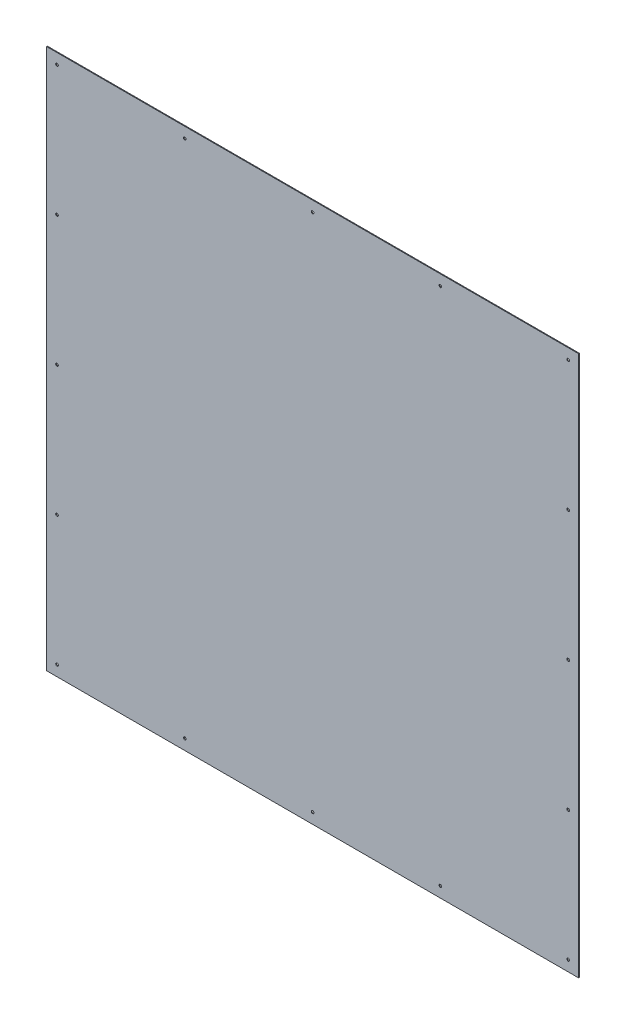
from build123d import *

# Parameters (mm, degrees)
CROQUIS1_W              = 1280
CROQUIS1_H              = 1300
SALIENTE_EXTRUIR1_DEPTH = 1.9
CROQUIS2_R              = 3.175
CORTAR_EXTRUIR2_DEPTH   = 120


with BuildPart() as part:
    # Croquis1 → Saliente-Extruir1 (new body)
    with BuildSketch(Plane.XY):
        Rectangle(CROQUIS1_W, CROQUIS1_H)
    extrude(amount=SALIENTE_EXTRUIR1_DEPTH)

    # Croquis2 → Cortar-Extruir2 (cut)
    with BuildSketch(Plane.XY.offset(1.9)):
        with Locations((-614.6, -624.6)):
            Circle(CROQUIS2_R)
        with Locations((-614.6, 624.6)):
            Circle(CROQUIS2_R)
        with Locations((614.6, 624.6)):
            Circle(CROQUIS2_R)
        with Locations((614.6, -624.6)):
            Circle(CROQUIS2_R)
        with Locations((0, -624.6)):
            Circle(CROQUIS2_R)
        with Locations((0, 624.6)):
            Circle(CROQUIS2_R)
        with Locations((307.3, -624.6)):
            Circle(CROQUIS2_R)
        with Locations((307.3, 624.6)):
            Circle(CROQUIS2_R)
        with Locations((-307.3, 624.6)):
            Circle(CROQUIS2_R)
        with Locations((-307.3, -624.6)):
            Circle(CROQUIS2_R)
        with Locations((-614.6, -312.3)):
            Circle(CROQUIS2_R)
        with Locations((-614.6, 0)):
            Circle(CROQUIS2_R)
        with Locations((-614.6, 312.3)):
            Circle(CROQUIS2_R)
        with Locations((614.6, 312.3)):
            Circle(CROQUIS2_R)
        with Locations((614.6, 0)):
            Circle(CROQUIS2_R)
        with Locations((614.6, -312.3)):
            Circle(CROQUIS2_R)
    extrude(amount=-CORTAR_EXTRUIR2_DEPTH, mode=Mode.SUBTRACT)


solid = part.part
